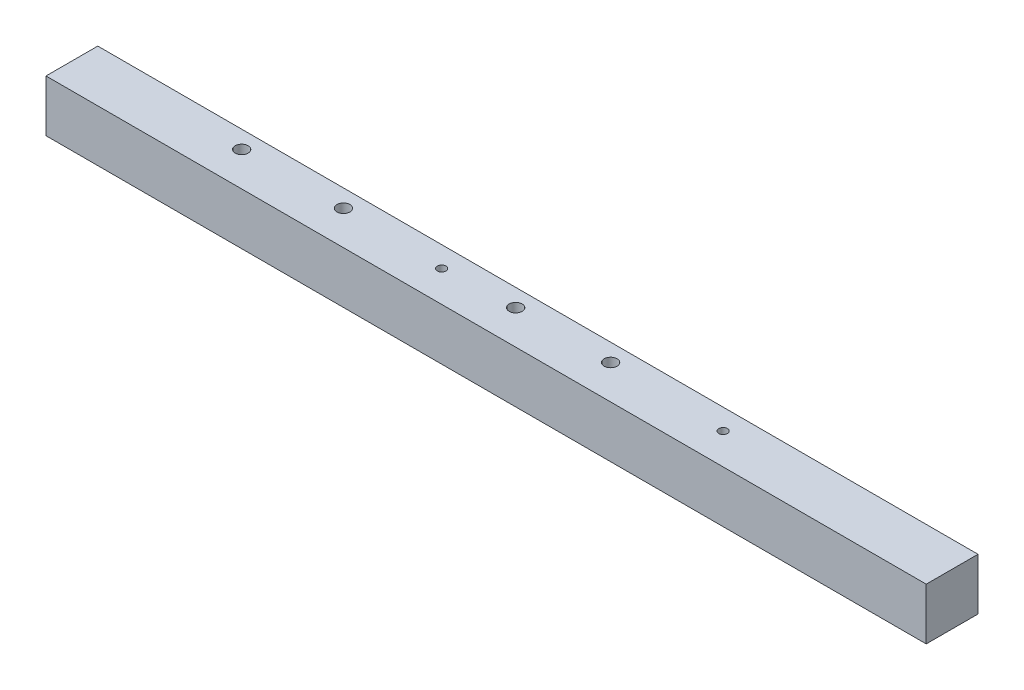
from build123d import *

# Parameters (mm, degrees)
SKETCH1_W           = 647.7
SKETCH1_H           = 38.1
SKETCH1_R           = 4.7625
SKETCH1_R_2         = 3.175
BOSS_EXTRUDE1_DEPTH = 38.1


with BuildPart() as part:
    # Sketch1 → Boss-Extrude1 (new body)
    with BuildSketch(Plane(origin=(0, 0, 0), x_dir=(1, 0, 0), z_dir=(0, 1, 0))):
        with Locations((323.85, 19.05)):
            Rectangle(SKETCH1_W, SKETCH1_H)
        with Locations(Location((118.802175491, 25.146, 0), (0, 0, 90))):
            Circle(SKETCH1_R, mode=Mode.SUBTRACT)
        with Locations(Location((193.732175491, 25.146, 0), (0, 0, 90))):
            Circle(SKETCH1_R, mode=Mode.SUBTRACT)
        with Locations(Location((320.470555491, 25.146, 0), (0, 0, 90))):
            Circle(SKETCH1_R, mode=Mode.SUBTRACT)
        with Locations(Location((390.320555491, 25.146, 0), (0, 0, 90))):
            Circle(SKETCH1_R, mode=Mode.SUBTRACT)
        with Locations(Location((268.254073092, 22.83757688, 0), (0, 0, 90))):
            Circle(SKETCH1_R_2, mode=Mode.SUBTRACT)
        with Locations(Location((475.391073092, 22.83757688, 0), (0, 0, 90))):
            Circle(SKETCH1_R_2, mode=Mode.SUBTRACT)
    extrude(amount=BOSS_EXTRUDE1_DEPTH)


solid = part.part
